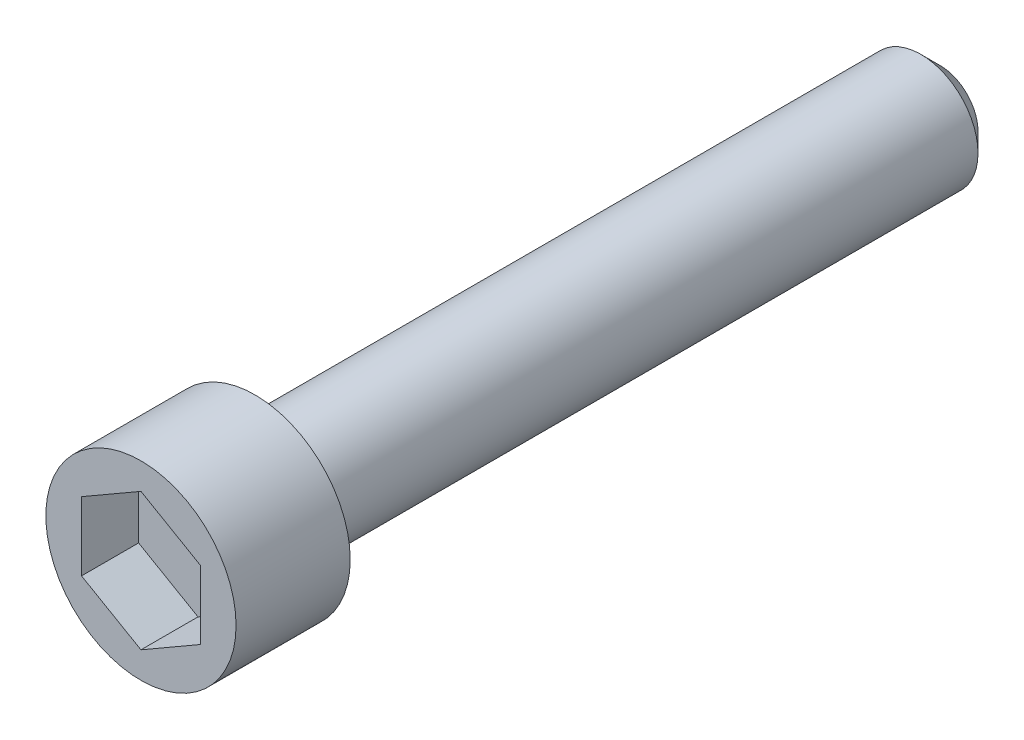
from build123d import *

# Parameters (mm, degrees)
SKETCH_1_R          = 1.5
EXTRUDE_1_DEPTH     = 18
SKETCH_2_R          = 2.5
EXTRUDE_2_DEPTH     = 3
CUT_EXTRUDE_1_DEPTH = 1.5
CHAMFER_1_SIZE      = 0.5


with BuildPart() as part:
    # 草图1 → 凸台-拉伸1 (new body)
    with BuildSketch(Plane.XY):
        Circle(SKETCH_1_R)
    extrude(amount=EXTRUDE_1_DEPTH)

    # 草图2 → 凸台-拉伸2 (add)
    with BuildSketch(Plane.XY.offset(18)):
        Circle(SKETCH_2_R)
    extrude(amount=EXTRUDE_2_DEPTH)

    # 草图3 → 切除-拉伸1 (cut)
    with BuildSketch(Plane.XY.offset(21)):
        Polygon((0, 1.803382283), (-1.56177487, 0.901691141), (-1.56177487, -0.901691141), (0, -1.803382283), (1.56177487, -0.901691141), (1.56177487, 0.901691141), align=None)
    extrude(amount=-CUT_EXTRUDE_1_DEPTH, mode=Mode.SUBTRACT)

    # 倒角1
    chamfer_1_edges = [part.edges().sort_by_distance(p)[0] for p in [
        (-1.5, 0, 0),
    ]]
    chamfer(chamfer_1_edges, length=CHAMFER_1_SIZE)


solid = part.part
